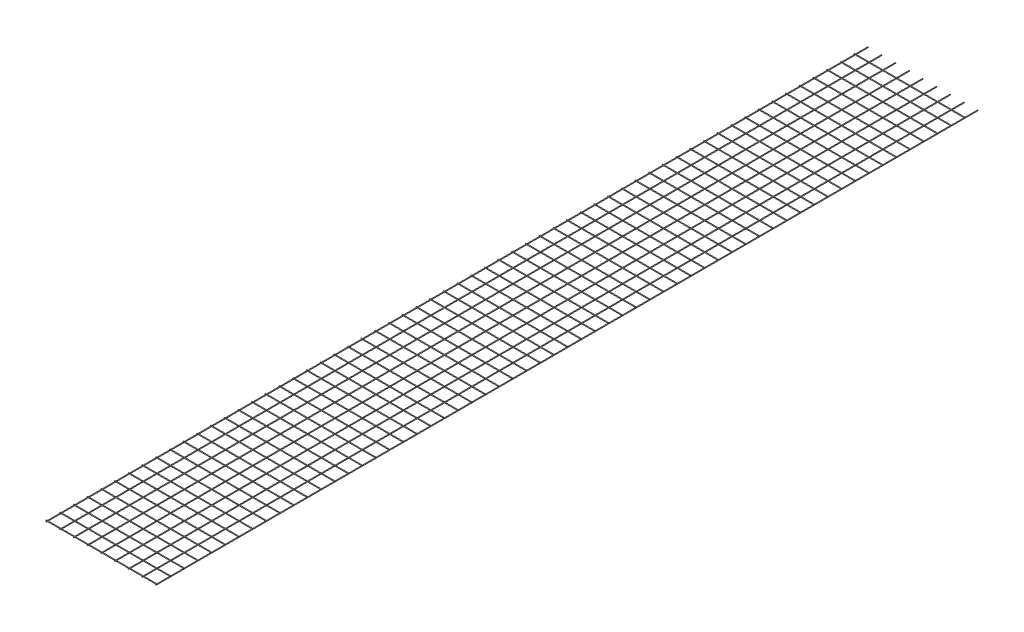
from build123d import *

# Parameters (mm, degrees)
SKETCH1_R              = 2.5
BOSS_EXTRUDE1_DEPTH    = 6000
BOSS_EXTRUDE1_2_DEPTH  = 6000
BOSS_EXTRUDE1_3_DEPTH  = 6000
BOSS_EXTRUDE1_4_DEPTH  = 6000
BOSS_EXTRUDE1_5_DEPTH  = 6000
BOSS_EXTRUDE1_6_DEPTH  = 6000
BOSS_EXTRUDE1_7_DEPTH  = 6000
BOSS_EXTRUDE1_8_DEPTH  = 6000
BOSS_EXTRUDE1_9_DEPTH  = 6000
SKETCH2_R              = 2.5
BOSS_EXTRUDE2_DEPTH    = 805
BOSS_EXTRUDE2_2_DEPTH  = 805
BOSS_EXTRUDE2_3_DEPTH  = 805
BOSS_EXTRUDE2_4_DEPTH  = 805
BOSS_EXTRUDE2_5_DEPTH  = 805
BOSS_EXTRUDE2_6_DEPTH  = 805
BOSS_EXTRUDE2_7_DEPTH  = 805
BOSS_EXTRUDE2_8_DEPTH  = 805
BOSS_EXTRUDE2_9_DEPTH  = 805
BOSS_EXTRUDE2_10_DEPTH = 805
BOSS_EXTRUDE2_11_DEPTH = 805
BOSS_EXTRUDE2_12_DEPTH = 805
BOSS_EXTRUDE2_13_DEPTH = 805
BOSS_EXTRUDE2_14_DEPTH = 805
BOSS_EXTRUDE2_15_DEPTH = 805
BOSS_EXTRUDE2_16_DEPTH = 805
BOSS_EXTRUDE2_17_DEPTH = 805
BOSS_EXTRUDE2_18_DEPTH = 805
BOSS_EXTRUDE2_19_DEPTH = 805
BOSS_EXTRUDE2_20_DEPTH = 805
BOSS_EXTRUDE2_21_DEPTH = 805
BOSS_EXTRUDE2_22_DEPTH = 805
BOSS_EXTRUDE2_23_DEPTH = 805
BOSS_EXTRUDE2_24_DEPTH = 805
BOSS_EXTRUDE2_25_DEPTH = 805
BOSS_EXTRUDE2_26_DEPTH = 805
BOSS_EXTRUDE2_27_DEPTH = 805
BOSS_EXTRUDE2_28_DEPTH = 805
BOSS_EXTRUDE2_29_DEPTH = 805
BOSS_EXTRUDE2_30_DEPTH = 805
BOSS_EXTRUDE2_31_DEPTH = 805
BOSS_EXTRUDE2_32_DEPTH = 805
BOSS_EXTRUDE2_33_DEPTH = 805
BOSS_EXTRUDE2_34_DEPTH = 805
BOSS_EXTRUDE2_35_DEPTH = 805
BOSS_EXTRUDE2_36_DEPTH = 805
BOSS_EXTRUDE2_37_DEPTH = 805
BOSS_EXTRUDE2_38_DEPTH = 805
BOSS_EXTRUDE2_39_DEPTH = 805
BOSS_EXTRUDE2_40_DEPTH = 805
BOSS_EXTRUDE2_41_DEPTH = 805
BOSS_EXTRUDE2_42_DEPTH = 805
BOSS_EXTRUDE2_43_DEPTH = 805
BOSS_EXTRUDE2_44_DEPTH = 805
BOSS_EXTRUDE2_45_DEPTH = 805
BOSS_EXTRUDE2_46_DEPTH = 805
BOSS_EXTRUDE2_47_DEPTH = 805
BOSS_EXTRUDE2_48_DEPTH = 805
BOSS_EXTRUDE2_49_DEPTH = 805
BOSS_EXTRUDE2_50_DEPTH = 805
BOSS_EXTRUDE2_51_DEPTH = 805
BOSS_EXTRUDE2_52_DEPTH = 805
BOSS_EXTRUDE2_53_DEPTH = 805
BOSS_EXTRUDE2_54_DEPTH = 805
BOSS_EXTRUDE2_55_DEPTH = 805
BOSS_EXTRUDE2_56_DEPTH = 805
BOSS_EXTRUDE2_57_DEPTH = 805
BOSS_EXTRUDE2_58_DEPTH = 805
BOSS_EXTRUDE2_59_DEPTH = 805
BOSS_EXTRUDE2_60_DEPTH = 805


with BuildPart() as part:
    # Sketch1 → Boss-Extrude1 (new body)
    with BuildSketch(Plane.XY):
        with Locations((-64.45419648, 0)):
            Circle(SKETCH1_R)
    extrude(amount=BOSS_EXTRUDE1_DEPTH)


with BuildPart() as body_2:
    # Sketch1 → Boss-Extrude1 2 (new body)
    with BuildSketch(Plane.XY):
        with Locations((35.54580352, 0)):
            Circle(SKETCH1_R)
    extrude(amount=BOSS_EXTRUDE1_2_DEPTH)


with BuildPart() as body_3:
    # Sketch1 → Boss-Extrude1 3 (new body)
    with BuildSketch(Plane.XY):
        with Locations((135.54580352, 0)):
            Circle(SKETCH1_R)
    extrude(amount=BOSS_EXTRUDE1_3_DEPTH)


with BuildPart() as body_4:
    # Sketch1 → Boss-Extrude1 4 (new body)
    with BuildSketch(Plane.XY):
        with Locations((235.54580352, 0)):
            Circle(SKETCH1_R)
    extrude(amount=BOSS_EXTRUDE1_4_DEPTH)


with BuildPart() as body_5:
    # Sketch1 → Boss-Extrude1 5 (new body)
    with BuildSketch(Plane.XY):
        with Locations((335.54580352, 0)):
            Circle(SKETCH1_R)
    extrude(amount=BOSS_EXTRUDE1_5_DEPTH)


with BuildPart() as body_6:
    # Sketch1 → Boss-Extrude1 6 (new body)
    with BuildSketch(Plane.XY):
        with Locations((435.54580352, 0)):
            Circle(SKETCH1_R)
    extrude(amount=BOSS_EXTRUDE1_6_DEPTH)


with BuildPart() as body_7:
    # Sketch1 → Boss-Extrude1 7 (new body)
    with BuildSketch(Plane.XY):
        with Locations((535.54580352, 0)):
            Circle(SKETCH1_R)
    extrude(amount=BOSS_EXTRUDE1_7_DEPTH)


with BuildPart() as body_8:
    # Sketch1 → Boss-Extrude1 8 (new body)
    with BuildSketch(Plane.XY):
        with Locations((635.54580352, 0)):
            Circle(SKETCH1_R)
    extrude(amount=BOSS_EXTRUDE1_8_DEPTH)


with BuildPart() as body_9:
    # Sketch1 → Boss-Extrude1 9 (new body)
    with BuildSketch(Plane.XY):
        with Locations((735.54580352, 0)):
            Circle(SKETCH1_R)
    extrude(amount=BOSS_EXTRUDE1_9_DEPTH)


with BuildPart() as body_10:
    # Sketch2 → Boss-Extrude2 (new body)
    with BuildSketch(Plane(origin=(738.04580352, 0, 0), x_dir=(0, 0, -1), z_dir=(1, 0, 0))):
        with Locations((-5997.5, 5)):
            Circle(SKETCH2_R)
    extrude(amount=-BOSS_EXTRUDE2_DEPTH)


with BuildPart() as body_11:
    # Sketch2 → Boss-Extrude2 2 (new body)
    with BuildSketch(Plane(origin=(738.04580352, 0, 0), x_dir=(0, 0, -1), z_dir=(1, 0, 0))):
        with Locations((-5897.5, 5)):
            Circle(SKETCH2_R)
    extrude(amount=-BOSS_EXTRUDE2_2_DEPTH)


with BuildPart() as body_12:
    # Sketch2 → Boss-Extrude2 3 (new body)
    with BuildSketch(Plane(origin=(738.04580352, 0, 0), x_dir=(0, 0, -1), z_dir=(1, 0, 0))):
        with Locations((-5797.5, 5)):
            Circle(SKETCH2_R)
    extrude(amount=-BOSS_EXTRUDE2_3_DEPTH)


with BuildPart() as body_13:
    # Sketch2 → Boss-Extrude2 4 (new body)
    with BuildSketch(Plane(origin=(738.04580352, 0, 0), x_dir=(0, 0, -1), z_dir=(1, 0, 0))):
        with Locations((-5697.5, 5)):
            Circle(SKETCH2_R)
    extrude(amount=-BOSS_EXTRUDE2_4_DEPTH)


with BuildPart() as body_14:
    # Sketch2 → Boss-Extrude2 5 (new body)
    with BuildSketch(Plane(origin=(738.04580352, 0, 0), x_dir=(0, 0, -1), z_dir=(1, 0, 0))):
        with Locations((-5597.5, 5)):
            Circle(SKETCH2_R)
    extrude(amount=-BOSS_EXTRUDE2_5_DEPTH)


with BuildPart() as body_15:
    # Sketch2 → Boss-Extrude2 6 (new body)
    with BuildSketch(Plane(origin=(738.04580352, 0, 0), x_dir=(0, 0, -1), z_dir=(1, 0, 0))):
        with Locations((-5497.5, 5)):
            Circle(SKETCH2_R)
    extrude(amount=-BOSS_EXTRUDE2_6_DEPTH)


with BuildPart() as body_16:
    # Sketch2 → Boss-Extrude2 7 (new body)
    with BuildSketch(Plane(origin=(738.04580352, 0, 0), x_dir=(0, 0, -1), z_dir=(1, 0, 0))):
        with Locations((-5397.5, 5)):
            Circle(SKETCH2_R)
    extrude(amount=-BOSS_EXTRUDE2_7_DEPTH)


with BuildPart() as body_17:
    # Sketch2 → Boss-Extrude2 8 (new body)
    with BuildSketch(Plane(origin=(738.04580352, 0, 0), x_dir=(0, 0, -1), z_dir=(1, 0, 0))):
        with Locations((-5297.5, 5)):
            Circle(SKETCH2_R)
    extrude(amount=-BOSS_EXTRUDE2_8_DEPTH)


with BuildPart() as body_18:
    # Sketch2 → Boss-Extrude2 9 (new body)
    with BuildSketch(Plane(origin=(738.04580352, 0, 0), x_dir=(0, 0, -1), z_dir=(1, 0, 0))):
        with Locations((-5197.5, 5)):
            Circle(SKETCH2_R)
    extrude(amount=-BOSS_EXTRUDE2_9_DEPTH)


with BuildPart() as body_19:
    # Sketch2 → Boss-Extrude2 10 (new body)
    with BuildSketch(Plane(origin=(738.04580352, 0, 0), x_dir=(0, 0, -1), z_dir=(1, 0, 0))):
        with Locations((-5097.5, 5)):
            Circle(SKETCH2_R)
    extrude(amount=-BOSS_EXTRUDE2_10_DEPTH)


with BuildPart() as body_20:
    # Sketch2 → Boss-Extrude2 11 (new body)
    with BuildSketch(Plane(origin=(738.04580352, 0, 0), x_dir=(0, 0, -1), z_dir=(1, 0, 0))):
        with Locations((-4997.5, 5)):
            Circle(SKETCH2_R)
    extrude(amount=-BOSS_EXTRUDE2_11_DEPTH)


with BuildPart() as body_21:
    # Sketch2 → Boss-Extrude2 12 (new body)
    with BuildSketch(Plane(origin=(738.04580352, 0, 0), x_dir=(0, 0, -1), z_dir=(1, 0, 0))):
        with Locations((-4897.5, 5)):
            Circle(SKETCH2_R)
    extrude(amount=-BOSS_EXTRUDE2_12_DEPTH)


with BuildPart() as body_22:
    # Sketch2 → Boss-Extrude2 13 (new body)
    with BuildSketch(Plane(origin=(738.04580352, 0, 0), x_dir=(0, 0, -1), z_dir=(1, 0, 0))):
        with Locations((-4797.5, 5)):
            Circle(SKETCH2_R)
    extrude(amount=-BOSS_EXTRUDE2_13_DEPTH)


with BuildPart() as body_23:
    # Sketch2 → Boss-Extrude2 14 (new body)
    with BuildSketch(Plane(origin=(738.04580352, 0, 0), x_dir=(0, 0, -1), z_dir=(1, 0, 0))):
        with Locations((-4697.5, 5)):
            Circle(SKETCH2_R)
    extrude(amount=-BOSS_EXTRUDE2_14_DEPTH)


with BuildPart() as body_24:
    # Sketch2 → Boss-Extrude2 15 (new body)
    with BuildSketch(Plane(origin=(738.04580352, 0, 0), x_dir=(0, 0, -1), z_dir=(1, 0, 0))):
        with Locations((-4597.5, 5)):
            Circle(SKETCH2_R)
    extrude(amount=-BOSS_EXTRUDE2_15_DEPTH)


with BuildPart() as body_25:
    # Sketch2 → Boss-Extrude2 16 (new body)
    with BuildSketch(Plane(origin=(738.04580352, 0, 0), x_dir=(0, 0, -1), z_dir=(1, 0, 0))):
        with Locations((-4497.5, 5)):
            Circle(SKETCH2_R)
    extrude(amount=-BOSS_EXTRUDE2_16_DEPTH)


with BuildPart() as body_26:
    # Sketch2 → Boss-Extrude2 17 (new body)
    with BuildSketch(Plane(origin=(738.04580352, 0, 0), x_dir=(0, 0, -1), z_dir=(1, 0, 0))):
        with Locations((-4397.5, 5)):
            Circle(SKETCH2_R)
    extrude(amount=-BOSS_EXTRUDE2_17_DEPTH)


with BuildPart() as body_27:
    # Sketch2 → Boss-Extrude2 18 (new body)
    with BuildSketch(Plane(origin=(738.04580352, 0, 0), x_dir=(0, 0, -1), z_dir=(1, 0, 0))):
        with Locations((-4297.5, 5)):
            Circle(SKETCH2_R)
    extrude(amount=-BOSS_EXTRUDE2_18_DEPTH)


with BuildPart() as body_28:
    # Sketch2 → Boss-Extrude2 19 (new body)
    with BuildSketch(Plane(origin=(738.04580352, 0, 0), x_dir=(0, 0, -1), z_dir=(1, 0, 0))):
        with Locations((-4197.5, 5)):
            Circle(SKETCH2_R)
    extrude(amount=-BOSS_EXTRUDE2_19_DEPTH)


with BuildPart() as body_29:
    # Sketch2 → Boss-Extrude2 20 (new body)
    with BuildSketch(Plane(origin=(738.04580352, 0, 0), x_dir=(0, 0, -1), z_dir=(1, 0, 0))):
        with Locations((-4097.5, 5)):
            Circle(SKETCH2_R)
    extrude(amount=-BOSS_EXTRUDE2_20_DEPTH)


with BuildPart() as body_30:
    # Sketch2 → Boss-Extrude2 21 (new body)
    with BuildSketch(Plane(origin=(738.04580352, 0, 0), x_dir=(0, 0, -1), z_dir=(1, 0, 0))):
        with Locations((-3997.5, 5)):
            Circle(SKETCH2_R)
    extrude(amount=-BOSS_EXTRUDE2_21_DEPTH)


with BuildPart() as body_31:
    # Sketch2 → Boss-Extrude2 22 (new body)
    with BuildSketch(Plane(origin=(738.04580352, 0, 0), x_dir=(0, 0, -1), z_dir=(1, 0, 0))):
        with Locations((-3897.5, 5)):
            Circle(SKETCH2_R)
    extrude(amount=-BOSS_EXTRUDE2_22_DEPTH)


with BuildPart() as body_32:
    # Sketch2 → Boss-Extrude2 23 (new body)
    with BuildSketch(Plane(origin=(738.04580352, 0, 0), x_dir=(0, 0, -1), z_dir=(1, 0, 0))):
        with Locations((-3797.5, 5)):
            Circle(SKETCH2_R)
    extrude(amount=-BOSS_EXTRUDE2_23_DEPTH)


with BuildPart() as body_33:
    # Sketch2 → Boss-Extrude2 24 (new body)
    with BuildSketch(Plane(origin=(738.04580352, 0, 0), x_dir=(0, 0, -1), z_dir=(1, 0, 0))):
        with Locations((-3697.5, 5)):
            Circle(SKETCH2_R)
    extrude(amount=-BOSS_EXTRUDE2_24_DEPTH)


with BuildPart() as body_34:
    # Sketch2 → Boss-Extrude2 25 (new body)
    with BuildSketch(Plane(origin=(738.04580352, 0, 0), x_dir=(0, 0, -1), z_dir=(1, 0, 0))):
        with Locations((-3597.5, 5)):
            Circle(SKETCH2_R)
    extrude(amount=-BOSS_EXTRUDE2_25_DEPTH)


with BuildPart() as body_35:
    # Sketch2 → Boss-Extrude2 26 (new body)
    with BuildSketch(Plane(origin=(738.04580352, 0, 0), x_dir=(0, 0, -1), z_dir=(1, 0, 0))):
        with Locations((-3497.5, 5)):
            Circle(SKETCH2_R)
    extrude(amount=-BOSS_EXTRUDE2_26_DEPTH)


with BuildPart() as body_36:
    # Sketch2 → Boss-Extrude2 27 (new body)
    with BuildSketch(Plane(origin=(738.04580352, 0, 0), x_dir=(0, 0, -1), z_dir=(1, 0, 0))):
        with Locations((-3397.5, 5)):
            Circle(SKETCH2_R)
    extrude(amount=-BOSS_EXTRUDE2_27_DEPTH)


with BuildPart() as body_37:
    # Sketch2 → Boss-Extrude2 28 (new body)
    with BuildSketch(Plane(origin=(738.04580352, 0, 0), x_dir=(0, 0, -1), z_dir=(1, 0, 0))):
        with Locations((-3297.5, 5)):
            Circle(SKETCH2_R)
    extrude(amount=-BOSS_EXTRUDE2_28_DEPTH)


with BuildPart() as body_38:
    # Sketch2 → Boss-Extrude2 29 (new body)
    with BuildSketch(Plane(origin=(738.04580352, 0, 0), x_dir=(0, 0, -1), z_dir=(1, 0, 0))):
        with Locations((-3197.5, 5)):
            Circle(SKETCH2_R)
    extrude(amount=-BOSS_EXTRUDE2_29_DEPTH)


with BuildPart() as body_39:
    # Sketch2 → Boss-Extrude2 30 (new body)
    with BuildSketch(Plane(origin=(738.04580352, 0, 0), x_dir=(0, 0, -1), z_dir=(1, 0, 0))):
        with Locations((-3097.5, 5)):
            Circle(SKETCH2_R)
    extrude(amount=-BOSS_EXTRUDE2_30_DEPTH)


with BuildPart() as body_40:
    # Sketch2 → Boss-Extrude2 31 (new body)
    with BuildSketch(Plane(origin=(738.04580352, 0, 0), x_dir=(0, 0, -1), z_dir=(1, 0, 0))):
        with Locations((-2997.5, 5)):
            Circle(SKETCH2_R)
    extrude(amount=-BOSS_EXTRUDE2_31_DEPTH)


with BuildPart() as body_41:
    # Sketch2 → Boss-Extrude2 32 (new body)
    with BuildSketch(Plane(origin=(738.04580352, 0, 0), x_dir=(0, 0, -1), z_dir=(1, 0, 0))):
        with Locations((-2897.5, 5)):
            Circle(SKETCH2_R)
    extrude(amount=-BOSS_EXTRUDE2_32_DEPTH)


with BuildPart() as body_42:
    # Sketch2 → Boss-Extrude2 33 (new body)
    with BuildSketch(Plane(origin=(738.04580352, 0, 0), x_dir=(0, 0, -1), z_dir=(1, 0, 0))):
        with Locations((-2797.5, 5)):
            Circle(SKETCH2_R)
    extrude(amount=-BOSS_EXTRUDE2_33_DEPTH)


with BuildPart() as body_43:
    # Sketch2 → Boss-Extrude2 34 (new body)
    with BuildSketch(Plane(origin=(738.04580352, 0, 0), x_dir=(0, 0, -1), z_dir=(1, 0, 0))):
        with Locations((-2697.5, 5)):
            Circle(SKETCH2_R)
    extrude(amount=-BOSS_EXTRUDE2_34_DEPTH)


with BuildPart() as body_44:
    # Sketch2 → Boss-Extrude2 35 (new body)
    with BuildSketch(Plane(origin=(738.04580352, 0, 0), x_dir=(0, 0, -1), z_dir=(1, 0, 0))):
        with Locations((-2597.5, 5)):
            Circle(SKETCH2_R)
    extrude(amount=-BOSS_EXTRUDE2_35_DEPTH)


with BuildPart() as body_45:
    # Sketch2 → Boss-Extrude2 36 (new body)
    with BuildSketch(Plane(origin=(738.04580352, 0, 0), x_dir=(0, 0, -1), z_dir=(1, 0, 0))):
        with Locations((-2497.5, 5)):
            Circle(SKETCH2_R)
    extrude(amount=-BOSS_EXTRUDE2_36_DEPTH)


with BuildPart() as body_46:
    # Sketch2 → Boss-Extrude2 37 (new body)
    with BuildSketch(Plane(origin=(738.04580352, 0, 0), x_dir=(0, 0, -1), z_dir=(1, 0, 0))):
        with Locations((-2397.5, 5)):
            Circle(SKETCH2_R)
    extrude(amount=-BOSS_EXTRUDE2_37_DEPTH)


with BuildPart() as body_47:
    # Sketch2 → Boss-Extrude2 38 (new body)
    with BuildSketch(Plane(origin=(738.04580352, 0, 0), x_dir=(0, 0, -1), z_dir=(1, 0, 0))):
        with Locations((-2297.5, 5)):
            Circle(SKETCH2_R)
    extrude(amount=-BOSS_EXTRUDE2_38_DEPTH)


with BuildPart() as body_48:
    # Sketch2 → Boss-Extrude2 39 (new body)
    with BuildSketch(Plane(origin=(738.04580352, 0, 0), x_dir=(0, 0, -1), z_dir=(1, 0, 0))):
        with Locations((-2197.5, 5)):
            Circle(SKETCH2_R)
    extrude(amount=-BOSS_EXTRUDE2_39_DEPTH)


with BuildPart() as body_49:
    # Sketch2 → Boss-Extrude2 40 (new body)
    with BuildSketch(Plane(origin=(738.04580352, 0, 0), x_dir=(0, 0, -1), z_dir=(1, 0, 0))):
        with Locations((-2097.5, 5)):
            Circle(SKETCH2_R)
    extrude(amount=-BOSS_EXTRUDE2_40_DEPTH)


with BuildPart() as body_50:
    # Sketch2 → Boss-Extrude2 41 (new body)
    with BuildSketch(Plane(origin=(738.04580352, 0, 0), x_dir=(0, 0, -1), z_dir=(1, 0, 0))):
        with Locations((-1997.5, 5)):
            Circle(SKETCH2_R)
    extrude(amount=-BOSS_EXTRUDE2_41_DEPTH)


with BuildPart() as body_51:
    # Sketch2 → Boss-Extrude2 42 (new body)
    with BuildSketch(Plane(origin=(738.04580352, 0, 0), x_dir=(0, 0, -1), z_dir=(1, 0, 0))):
        with Locations((-1897.5, 5)):
            Circle(SKETCH2_R)
    extrude(amount=-BOSS_EXTRUDE2_42_DEPTH)


with BuildPart() as body_52:
    # Sketch2 → Boss-Extrude2 43 (new body)
    with BuildSketch(Plane(origin=(738.04580352, 0, 0), x_dir=(0, 0, -1), z_dir=(1, 0, 0))):
        with Locations((-1797.5, 5)):
            Circle(SKETCH2_R)
    extrude(amount=-BOSS_EXTRUDE2_43_DEPTH)


with BuildPart() as body_53:
    # Sketch2 → Boss-Extrude2 44 (new body)
    with BuildSketch(Plane(origin=(738.04580352, 0, 0), x_dir=(0, 0, -1), z_dir=(1, 0, 0))):
        with Locations((-1697.5, 5)):
            Circle(SKETCH2_R)
    extrude(amount=-BOSS_EXTRUDE2_44_DEPTH)


with BuildPart() as body_54:
    # Sketch2 → Boss-Extrude2 45 (new body)
    with BuildSketch(Plane(origin=(738.04580352, 0, 0), x_dir=(0, 0, -1), z_dir=(1, 0, 0))):
        with Locations((-1597.5, 5)):
            Circle(SKETCH2_R)
    extrude(amount=-BOSS_EXTRUDE2_45_DEPTH)


with BuildPart() as body_55:
    # Sketch2 → Boss-Extrude2 46 (new body)
    with BuildSketch(Plane(origin=(738.04580352, 0, 0), x_dir=(0, 0, -1), z_dir=(1, 0, 0))):
        with Locations((-1497.5, 5)):
            Circle(SKETCH2_R)
    extrude(amount=-BOSS_EXTRUDE2_46_DEPTH)


with BuildPart() as body_56:
    # Sketch2 → Boss-Extrude2 47 (new body)
    with BuildSketch(Plane(origin=(738.04580352, 0, 0), x_dir=(0, 0, -1), z_dir=(1, 0, 0))):
        with Locations((-1397.5, 5)):
            Circle(SKETCH2_R)
    extrude(amount=-BOSS_EXTRUDE2_47_DEPTH)


with BuildPart() as body_57:
    # Sketch2 → Boss-Extrude2 48 (new body)
    with BuildSketch(Plane(origin=(738.04580352, 0, 0), x_dir=(0, 0, -1), z_dir=(1, 0, 0))):
        with Locations((-1297.5, 5)):
            Circle(SKETCH2_R)
    extrude(amount=-BOSS_EXTRUDE2_48_DEPTH)


with BuildPart() as body_58:
    # Sketch2 → Boss-Extrude2 49 (new body)
    with BuildSketch(Plane(origin=(738.04580352, 0, 0), x_dir=(0, 0, -1), z_dir=(1, 0, 0))):
        with Locations((-1197.5, 5)):
            Circle(SKETCH2_R)
    extrude(amount=-BOSS_EXTRUDE2_49_DEPTH)


with BuildPart() as body_59:
    # Sketch2 → Boss-Extrude2 50 (new body)
    with BuildSketch(Plane(origin=(738.04580352, 0, 0), x_dir=(0, 0, -1), z_dir=(1, 0, 0))):
        with Locations((-1097.5, 5)):
            Circle(SKETCH2_R)
    extrude(amount=-BOSS_EXTRUDE2_50_DEPTH)


with BuildPart() as body_60:
    # Sketch2 → Boss-Extrude2 51 (new body)
    with BuildSketch(Plane(origin=(738.04580352, 0, 0), x_dir=(0, 0, -1), z_dir=(1, 0, 0))):
        with Locations((-997.5, 5)):
            Circle(SKETCH2_R)
    extrude(amount=-BOSS_EXTRUDE2_51_DEPTH)


with BuildPart() as body_61:
    # Sketch2 → Boss-Extrude2 52 (new body)
    with BuildSketch(Plane(origin=(738.04580352, 0, 0), x_dir=(0, 0, -1), z_dir=(1, 0, 0))):
        with Locations((-897.5, 5)):
            Circle(SKETCH2_R)
    extrude(amount=-BOSS_EXTRUDE2_52_DEPTH)


with BuildPart() as body_62:
    # Sketch2 → Boss-Extrude2 53 (new body)
    with BuildSketch(Plane(origin=(738.04580352, 0, 0), x_dir=(0, 0, -1), z_dir=(1, 0, 0))):
        with Locations((-797.5, 5)):
            Circle(SKETCH2_R)
    extrude(amount=-BOSS_EXTRUDE2_53_DEPTH)


with BuildPart() as body_63:
    # Sketch2 → Boss-Extrude2 54 (new body)
    with BuildSketch(Plane(origin=(738.04580352, 0, 0), x_dir=(0, 0, -1), z_dir=(1, 0, 0))):
        with Locations((-697.5, 5)):
            Circle(SKETCH2_R)
    extrude(amount=-BOSS_EXTRUDE2_54_DEPTH)


with BuildPart() as body_64:
    # Sketch2 → Boss-Extrude2 55 (new body)
    with BuildSketch(Plane(origin=(738.04580352, 0, 0), x_dir=(0, 0, -1), z_dir=(1, 0, 0))):
        with Locations((-597.5, 5)):
            Circle(SKETCH2_R)
    extrude(amount=-BOSS_EXTRUDE2_55_DEPTH)


with BuildPart() as body_65:
    # Sketch2 → Boss-Extrude2 56 (new body)
    with BuildSketch(Plane(origin=(738.04580352, 0, 0), x_dir=(0, 0, -1), z_dir=(1, 0, 0))):
        with Locations((-497.5, 5)):
            Circle(SKETCH2_R)
    extrude(amount=-BOSS_EXTRUDE2_56_DEPTH)


with BuildPart() as body_66:
    # Sketch2 → Boss-Extrude2 57 (new body)
    with BuildSketch(Plane(origin=(738.04580352, 0, 0), x_dir=(0, 0, -1), z_dir=(1, 0, 0))):
        with Locations((-397.5, 5)):
            Circle(SKETCH2_R)
    extrude(amount=-BOSS_EXTRUDE2_57_DEPTH)


with BuildPart() as body_67:
    # Sketch2 → Boss-Extrude2 58 (new body)
    with BuildSketch(Plane(origin=(738.04580352, 0, 0), x_dir=(0, 0, -1), z_dir=(1, 0, 0))):
        with Locations((-297.5, 5)):
            Circle(SKETCH2_R)
    extrude(amount=-BOSS_EXTRUDE2_58_DEPTH)


with BuildPart() as body_68:
    # Sketch2 → Boss-Extrude2 59 (new body)
    with BuildSketch(Plane(origin=(738.04580352, 0, 0), x_dir=(0, 0, -1), z_dir=(1, 0, 0))):
        with Locations((-197.5, 5)):
            Circle(SKETCH2_R)
    extrude(amount=-BOSS_EXTRUDE2_59_DEPTH)


with BuildPart() as body_69:
    # Sketch2 → Boss-Extrude2 60 (new body)
    with BuildSketch(Plane(origin=(738.04580352, 0, 0), x_dir=(0, 0, -1), z_dir=(1, 0, 0))):
        with Locations((-97.5, 5)):
            Circle(SKETCH2_R)
    extrude(amount=-BOSS_EXTRUDE2_60_DEPTH)


solid = Compound([part.part, body_2.part, body_3.part, body_4.part, body_5.part, body_6.part, body_7.part, body_8.part, body_9.part, body_10.part, body_11.part, body_12.part, body_13.part, body_14.part, body_15.part, body_16.part, body_17.part, body_18.part, body_19.part, body_20.part, body_21.part, body_22.part, body_23.part, body_24.part, body_25.part, body_26.part, body_27.part, body_28.part, body_29.part, body_30.part, body_31.part, body_32.part, body_33.part, body_34.part, body_35.part, body_36.part, body_37.part, body_38.part, body_39.part, body_40.part, body_41.part, body_42.part, body_43.part, body_44.part, body_45.part, body_46.part, body_47.part, body_48.part, body_49.part, body_50.part, body_51.part, body_52.part, body_53.part, body_54.part, body_55.part, body_56.part, body_57.part, body_58.part, body_59.part, body_60.part, body_61.part, body_62.part, body_63.part, body_64.part, body_65.part, body_66.part, body_67.part, body_68.part, body_69.part])
